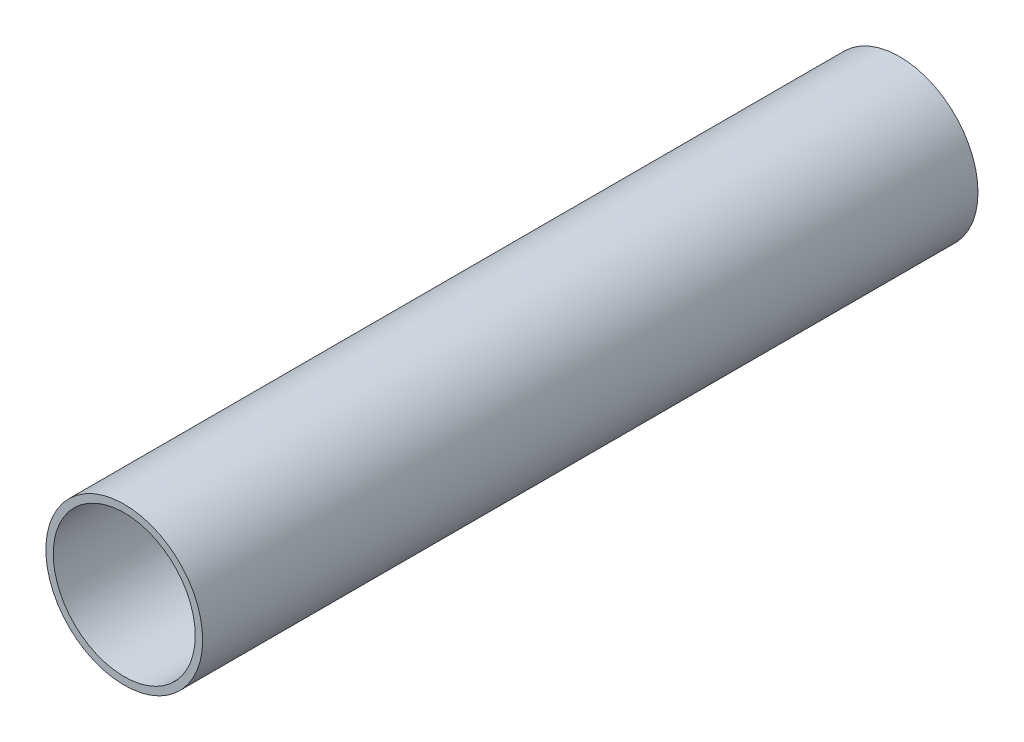
from build123d import *

# Parameters (mm, degrees)
SKETCH_1_R      = 31.75
SKETCH_1_R_2    = 28.75
EXTRUDE_1_DEPTH = 157


with BuildPart() as part:
    # Эскиз1 → Бобышка-Вытянуть1 (new, symmetric)
    with BuildSketch(Plane.XY):
        Circle(SKETCH_1_R)
        Circle(SKETCH_1_R_2, mode=Mode.SUBTRACT)
    extrude(amount=EXTRUDE_1_DEPTH, both=True)


solid = part.part
